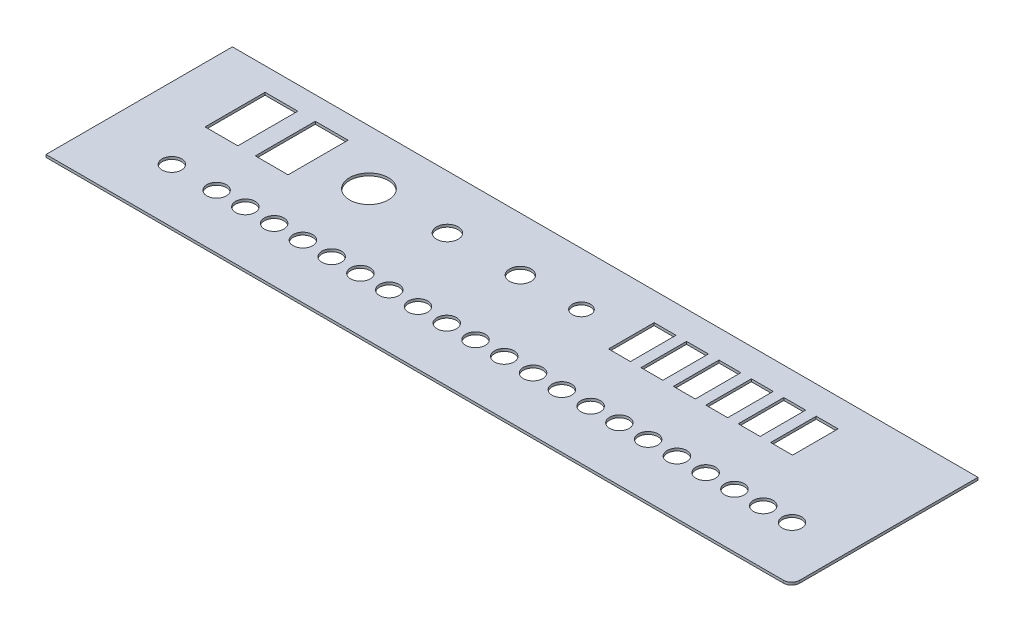
from build123d import *

# Parameters (mm, degrees)
SKETCH4_R           = 11.95
SKETCH4_R_2         = 6.65
SKETCH4_R_3         = 5.6
SKETCH4_R_4         = 6
SKETCH4_W           = 20.218579234
SKETCH4_H           = 37
SKETCH4_W_2         = 13.5
SKETCH4_H_2         = 28.1
BOSS_EXTRUDE1_DEPTH = 1.6


with BuildPart() as part:
    # Sketch4 → Boss-Extrude1 (new body)
    with BuildSketch(Plane(origin=(0, 0, 0), x_dir=(1, 0, 0), z_dir=(0, 1, 0))):
        with BuildLine():
            Line((-60.547420146, 63.390203379), (394.452579854, 63.390203379))
            Line((394.452579854, 63.390203379), (396.952579854, 63.390203379))
            Line((396.952579854, 63.390203379), (396.952579854, -46.609796621))
            ThreePointArc((396.952579854, -46.609796621), (395.48811376, -50.145330527), (391.952579854, -51.609796621))
            Line((391.952579854, -51.609796621), (-60.547420146, -51.609796621))
            Line((-60.547420146, -51.609796621), (-63.047420146, -51.609796621))
            Line((-63.047420146, -51.609796621), (-63.047420146, 63.390203379))
            Line((-63.047420146, 63.390203379), (-60.547420146, 63.390203379))
        make_face()
        with Locations(Location((54.9, 29.690203379, 0), (0, 0, 270))):
            Circle(SKETCH4_R, mode=Mode.SUBTRACT)
        with Locations(Location((102.75, 30.240203379, 0), (0, 0, 270))):
            Circle(SKETCH4_R_2, mode=Mode.SUBTRACT)
        with Locations(Location((147.75, 30.240203379, 0), (0, 0, 270))):
            Circle(SKETCH4_R_2, mode=Mode.SUBTRACT)
        with Locations(Location((184.9, 30.790203379, 0), (0, 0, 270))):
            Circle(SKETCH4_R_3, mode=Mode.SUBTRACT)
        with Locations(Location((-18.9, -18.109796621, 0), (0, 0, 270))):
            Circle(SKETCH4_R_4, mode=Mode.SUBTRACT)
        with Locations(Location((8.7, -18.109796621, 0), (0, 0, 270))):
            Circle(SKETCH4_R_4, mode=Mode.SUBTRACT)
        with Locations(Location((26.45, -18.109796621, 0), (0, 0, 270))):
            Circle(SKETCH4_R_4, mode=Mode.SUBTRACT)
        with Locations(Location((44.2, -18.109796621, 0), (0, 0, 270))):
            Circle(SKETCH4_R_4, mode=Mode.SUBTRACT)
        with Locations(Location((61.95, -18.109796621, 0), (0, 0, 270))):
            Circle(SKETCH4_R_4, mode=Mode.SUBTRACT)
        with Locations(Location((79.7, -18.109796621, 0), (0, 0, 270))):
            Circle(SKETCH4_R_4, mode=Mode.SUBTRACT)
        with Locations(Location((97.45, -18.109796621, 0), (0, 0, 270))):
            Circle(SKETCH4_R_4, mode=Mode.SUBTRACT)
        with Locations(Location((115.2, -18.109796621, 0), (0, 0, 270))):
            Circle(SKETCH4_R_4, mode=Mode.SUBTRACT)
        with Locations(Location((132.95, -18.109796621, 0), (0, 0, 270))):
            Circle(SKETCH4_R_4, mode=Mode.SUBTRACT)
        with Locations(Location((150.7, -18.109796621, 0), (0, 0, 270))):
            Circle(SKETCH4_R_4, mode=Mode.SUBTRACT)
        with Locations(Location((168.45, -18.109796621, 0), (0, 0, 270))):
            Circle(SKETCH4_R_4, mode=Mode.SUBTRACT)
        with Locations(Location((186.2, -18.109796621, 0), (0, 0, 270))):
            Circle(SKETCH4_R_4, mode=Mode.SUBTRACT)
        with Locations(Location((203.95, -18.109796621, 0), (0, 0, 270))):
            Circle(SKETCH4_R_4, mode=Mode.SUBTRACT)
        with Locations(Location((221.7, -18.109796621, 0), (0, 0, 270))):
            Circle(SKETCH4_R_4, mode=Mode.SUBTRACT)
        with Locations(Location((239.45, -18.109796621, 0), (0, 0, 270))):
            Circle(SKETCH4_R_4, mode=Mode.SUBTRACT)
        with Locations(Location((257.2, -18.109796621, 0), (0, 0, 270))):
            Circle(SKETCH4_R_4, mode=Mode.SUBTRACT)
        with Locations(Location((274.95, -18.109796621, 0), (0, 0, 270))):
            Circle(SKETCH4_R_4, mode=Mode.SUBTRACT)
        with Locations(Location((292.7, -18.109796621, 0), (0, 0, 270))):
            Circle(SKETCH4_R_4, mode=Mode.SUBTRACT)
        with Locations(Location((310.45, -18.109796621, 0), (0, 0, 270))):
            Circle(SKETCH4_R_4, mode=Mode.SUBTRACT)
        with Locations(Location((328.2, -18.109796621, 0), (0, 0, 270))):
            Circle(SKETCH4_R_4, mode=Mode.SUBTRACT)
        with Locations(Location((345.95, -18.109796621, 0), (0, 0, 270))):
            Circle(SKETCH4_R_4, mode=Mode.SUBTRACT)
        with Locations(Location((363.7, -18.109796621, 0), (0, 0, 270))):
            Circle(SKETCH4_R_4, mode=Mode.SUBTRACT)
        with Locations((-18.6, 30.690203379)):
            Rectangle(SKETCH4_W, SKETCH4_H, mode=Mode.SUBTRACT)
        with Locations((12.4, 30.690203379)):
            Rectangle(SKETCH4_W, SKETCH4_H, mode=Mode.SUBTRACT)
        with Locations((241.15, 32.073143277)):
            Rectangle(SKETCH4_W_2, SKETCH4_H_2, mode=Mode.SUBTRACT)
        with Locations((221.15, 32.073143277)):
            Rectangle(SKETCH4_W_2, SKETCH4_H_2, mode=Mode.SUBTRACT)
        with Locations((261.15, 32.073143277)):
            Rectangle(SKETCH4_W_2, SKETCH4_H_2, mode=Mode.SUBTRACT)
        with Locations((281.15, 32.073143277)):
            Rectangle(SKETCH4_W_2, SKETCH4_H_2, mode=Mode.SUBTRACT)
        with Locations((301.15, 32.073143277)):
            Rectangle(SKETCH4_W_2, SKETCH4_H_2, mode=Mode.SUBTRACT)
        with Locations((321.15, 32.073143277)):
            Rectangle(SKETCH4_W_2, SKETCH4_H_2, mode=Mode.SUBTRACT)
    extrude(amount=BOSS_EXTRUDE1_DEPTH)


solid = part.part
